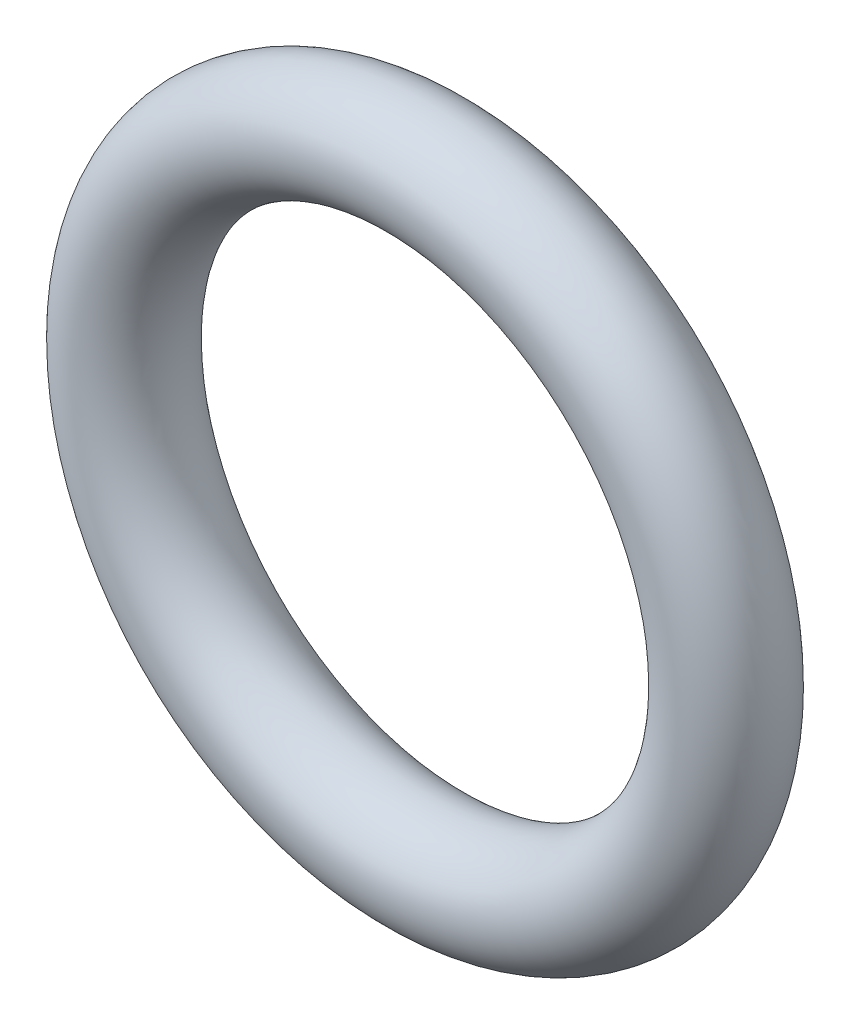
from build123d import *

# Parameters (mm, degrees)
SKETCH_1_R = 1.5


with BuildPart() as part:
    # Эскиз1 → Повернуть1 (revolve)
    with BuildSketch(Plane(origin=(0, 0, 0), x_dir=(1, 0, 0), z_dir=(0, 1, 0)), mode=Mode.PRIVATE) as revolve_1_sk:
        with Locations((-8.25, 1.5)):
            Circle(SKETCH_1_R)
    revolve(revolve_1_sk.sketch.rotate(Axis((0, 0, 0), (0, 0, -1)), 180), axis=Axis((0, 0, 0), (0, 0, -1)))


solid = part.part
